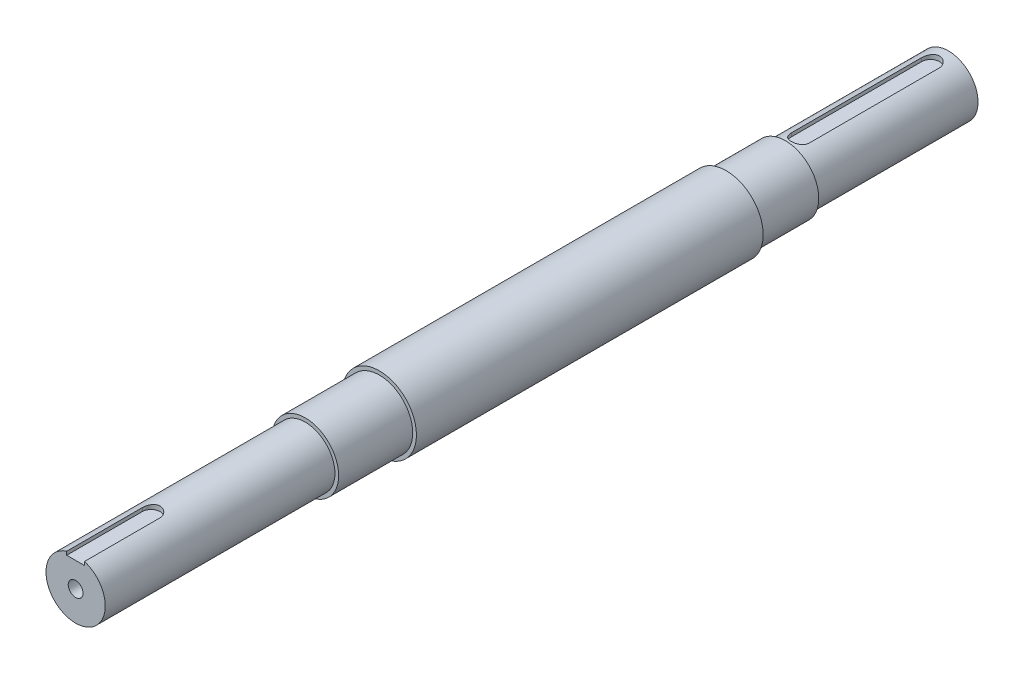
from build123d import *

# Parameters (mm, degrees)
SKETCH1_R                  = 25
BOSS_EXTRUDE1_DEPTH        = 234
SKETCH2_R                  = 22.5
BOSS_EXTRUDE2_DEPTH        = 40
SKETCH3_R                  = 20
BOSS_EXTRUDE3_DEPTH        = 110
BOSS_EXTRUDE4_START        = 50
SKETCH4_R                  = 22.5
BOSS_EXTRUDE4_DEPTH        = 50
BOSS_EXTRUDE5_START        = 155
SKETCH5_R                  = 20
BOSS_EXTRUDE5_DEPTH        = 155
CUT_EXTRUDE1_DEPTH         = 3.3
SKETCH7_R                  = 5
CUT_EXTRUDE2_DEPTH         = 45
CUT_EXTRUDE3_DEPTH         = 3.3
F_10_0MM_DOWEL_HOLE1_D     = 10
F_10_0MM_DOWEL_HOLE1_DEPTH = 45
F_10_0MM_DOWEL_HOLE1_TIP   = 3.004303095


with BuildPart() as part:
    # Sketch1 → Boss-Extrude1 (new body)
    with BuildSketch(Plane.XY):
        Circle(SKETCH1_R)
    extrude(amount=BOSS_EXTRUDE1_DEPTH)

    # Sketch2 → Boss-Extrude2 (add)
    with BuildSketch(Plane(origin=(0, 0, 0), x_dir=(-1, 0, 0), z_dir=(0, 0, -1))):
        Circle(SKETCH2_R)
    extrude(amount=BOSS_EXTRUDE2_DEPTH)

    # Sketch3 → Boss-Extrude3 (add)
    with BuildSketch(Plane(origin=(0, 0, -40), x_dir=(-1, 0, 0), z_dir=(0, 0, -1))):
        Circle(SKETCH3_R)
    extrude(amount=BOSS_EXTRUDE3_DEPTH)

    # Sketch4 → Boss-Extrude4 (add)
    with BuildSketch(Plane.XY.offset(234).offset(BOSS_EXTRUDE4_START)):
        with Locations(Location((0, 0, 0), (0, 0, 180))):
            Circle(SKETCH4_R)
    extrude(amount=-BOSS_EXTRUDE4_DEPTH)

    # Sketch5 → Boss-Extrude5 (add)
    with BuildSketch(Plane.XY.offset(284).offset(BOSS_EXTRUDE5_START)):
        with Locations(Location((0, 0, 0), (0, 0, 180))):
            Circle(SKETCH5_R)
    extrude(amount=-BOSS_EXTRUDE5_DEPTH)

    # Sketch6 → Cut-Extrude1 (cut)
    with BuildSketch(Plane(origin=(0, 20, 0), x_dir=(1, 0, 0), z_dir=(0, 1, 0))):
        with BuildLine():
            Line((-6, -439), (-6, -388))
            ThreePointArc((-6, -388), (0, -382), (6, -388))
            Line((6, -388), (6, -439))
            ThreePointArc((6, -439), (0, -445), (-6, -439))
        make_face()
    extrude(amount=-CUT_EXTRUDE1_DEPTH, mode=Mode.SUBTRACT)

    # Sketch7 → Cut-Extrude2 (cut)
    with BuildSketch(Plane.XY.offset(439)):
        Circle(SKETCH7_R)
    extrude(amount=-CUT_EXTRUDE2_DEPTH, mode=Mode.SUBTRACT)

    # Sketch8 → Cut-Extrude3 (cut)
    with BuildSketch(Plane(origin=(0, 20, 0), x_dir=(1, 0, 0), z_dir=(0, 1, 0))):
        with BuildLine():
            Line((6, 138), (6, 50))
            ThreePointArc((6, 50), (0, 44), (-6, 50))
            Line((-6, 50), (-6, 138))
            ThreePointArc((-6, 138), (0, 144), (6, 138))
        make_face()
    extrude(amount=-CUT_EXTRUDE3_DEPTH, mode=Mode.SUBTRACT)

    # Ø10.0mm Dowel Hole1
    with Locations(Plane(origin=(0, 0, -150), x_dir=(-1, 0, 0), z_dir=(0, 0, -1))):
        with Locations((0, 0)):
            Hole(F_10_0MM_DOWEL_HOLE1_D / 2, depth=F_10_0MM_DOWEL_HOLE1_DEPTH)
            with Locations((0, 0, -(F_10_0MM_DOWEL_HOLE1_DEPTH + F_10_0MM_DOWEL_HOLE1_TIP / 2))):  # 118° drill point
                Cone(0, F_10_0MM_DOWEL_HOLE1_D / 2, F_10_0MM_DOWEL_HOLE1_TIP, mode=Mode.SUBTRACT)


solid = part.part
